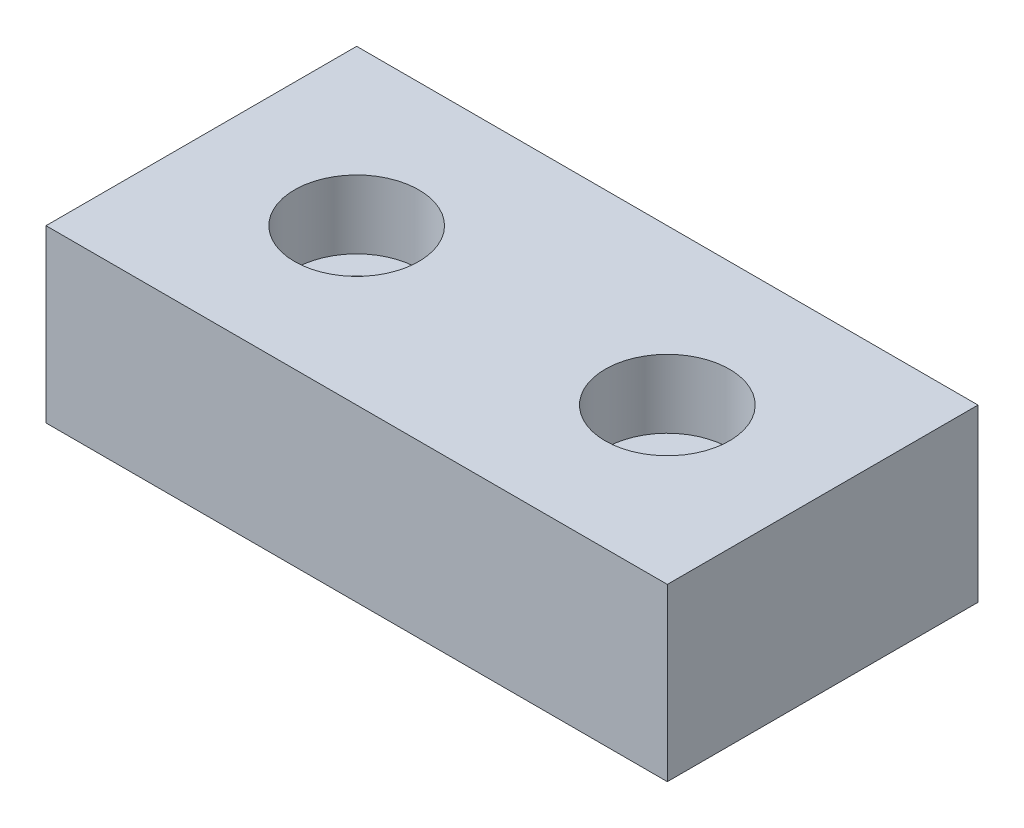
from build123d import *

# Parameters (mm, degrees)
SKETCH1_W                                           = 40
SKETCH1_H                                           = 20
BOSS_EXTRUDE1_DEPTH                                 = 11
CBORE_FOR_M4_HEX_SOCKET_HEAD_CAP_SCREW1_D           = 4.5
CBORE_FOR_M4_HEX_SOCKET_HEAD_CAP_SCREW1_CBORE_D     = 8
CBORE_FOR_M4_HEX_SOCKET_HEAD_CAP_SCREW1_CBORE_DEPTH = 4.4


with BuildPart() as part:
    # Sketch1 → Boss-Extrude1 (new body)
    with BuildSketch(Plane(origin=(0, 0, 0), x_dir=(1, 0, 0), z_dir=(0, 1, 0))):
        with Locations((20, 10)):
            Rectangle(SKETCH1_W, SKETCH1_H)
    extrude(amount=BOSS_EXTRUDE1_DEPTH)

    # CBORE for M4 Hex Socket Head Cap Screw1 (through all)
    with Locations(Plane(origin=(0, 11, 0), x_dir=(1, 0, 0), z_dir=(0, 1, 0))):
        with Locations((10, 10), (30, 10)):
            CounterBoreHole(CBORE_FOR_M4_HEX_SOCKET_HEAD_CAP_SCREW1_D / 2, CBORE_FOR_M4_HEX_SOCKET_HEAD_CAP_SCREW1_CBORE_D / 2, CBORE_FOR_M4_HEX_SOCKET_HEAD_CAP_SCREW1_CBORE_DEPTH)


solid = part.part
